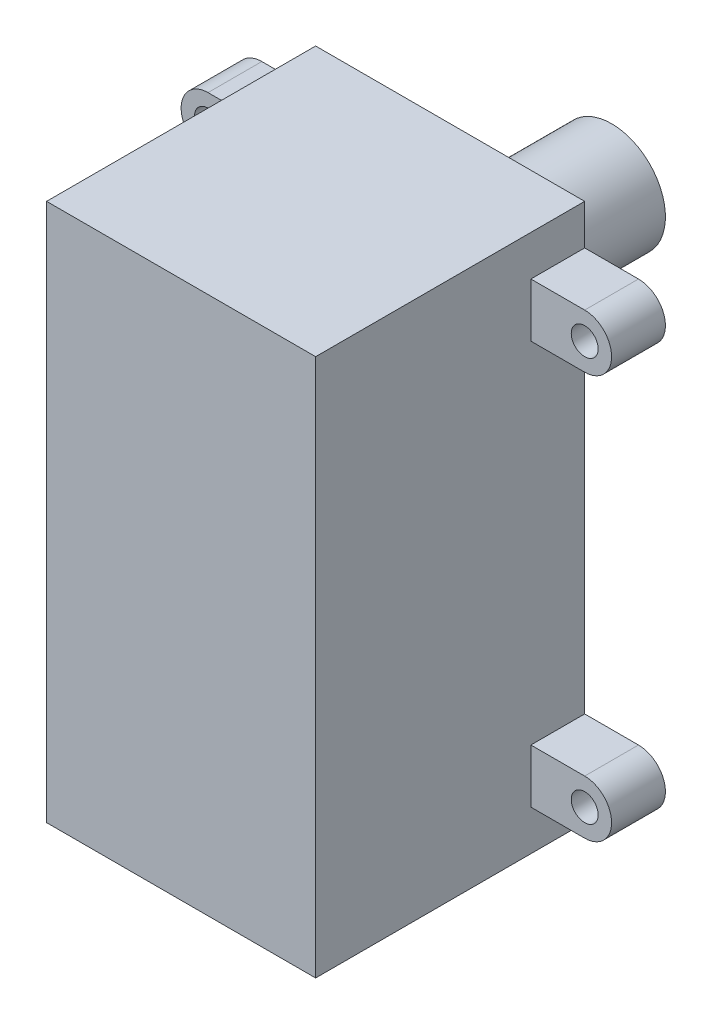
from build123d import *

# Parameters (mm, degrees)
SKETCH1_W           = 100
SKETCH1_H           = 50
BOSS_EXTRUDE1_DEPTH = 50
SKETCH2_R           = 2.5
BOSS_EXTRUDE2_DEPTH = 10
SKETCH3_R           = 10
BOSS_EXTRUDE3_DEPTH = 30


with BuildPart() as part:
    # Sketch1 → Boss-Extrude1 (new body)
    with BuildSketch(Plane(origin=(0, 0, 0), x_dir=(0, 1, 0), z_dir=(0, 0, 1))):
        with Locations((45, -21.706161137)):
            Rectangle(SKETCH1_W, SKETCH1_H)
    extrude(amount=BOSS_EXTRUDE1_DEPTH)

    # Sketch2 → Boss-Extrude2 (add)
    # profile 1 of 4: a face of its own
    with BuildSketch(Plane(origin=(0, 0, 0), x_dir=(1, 0, 0), z_dir=(0, 0, -1))):
        with BuildLine():
            Line((-3.293838863, -2.5), (-13.293838863, -2.5))
            ThreePointArc((-13.293838863, -2.5), (-18.293838863, -7.5), (-13.293838863, -12.5))
            Line((-13.293838863, -12.5), (-3.293838863, -12.5))
            Line((-3.293838863, -12.5), (-3.293838863, -2.5))
        make_face()
        with Locations(Location((-13.293838863, -7.5, 0), (0, 0, 180))):
            Circle(SKETCH2_R, mode=Mode.SUBTRACT)
    # profile 2 of 4: a face of its own
    with BuildSketch(Plane(origin=(0, 0, 0), x_dir=(1, 0, 0), z_dir=(0, 0, -1))):
        with BuildLine():
            Line((-3.293838863, -77.5), (-3.293838863, -87.5))
            Line((-3.293838863, -87.5), (-13.293838863, -87.5))
            ThreePointArc((-13.293838863, -87.5), (-18.293838863, -82.5), (-13.293838863, -77.5))
            Line((-13.293838863, -77.5), (-3.293838863, -77.5))
        make_face()
        with Locations((-13.293838863, -82.5)):
            Circle(SKETCH2_R, mode=Mode.SUBTRACT)
    # profile 3 of 4: a face of its own
    with BuildSketch(Plane(origin=(0, 0, 0), x_dir=(1, 0, 0), z_dir=(0, 0, -1))):
        with BuildLine():
            Line((46.706161137, -87.5), (56.706161137, -87.5))
            ThreePointArc((56.706161137, -87.5), (61.706161137, -82.5), (56.706161137, -77.5))
            Line((56.706161137, -77.5), (46.706161137, -77.5))
            Line((46.706161137, -77.5), (46.706161137, -87.5))
        make_face()
        with Locations(Location((56.706161137, -82.5, 0), (0, 0, 180))):
            Circle(SKETCH2_R, mode=Mode.SUBTRACT)
    # profile 4 of 4: a face of its own
    with BuildSketch(Plane(origin=(0, 0, 0), x_dir=(1, 0, 0), z_dir=(0, 0, -1))):
        with BuildLine():
            Line((46.706161137, -12.5), (46.706161137, -2.5))
            Line((46.706161137, -2.5), (56.706161137, -2.5))
            ThreePointArc((56.706161137, -2.5), (61.706161137, -7.5), (56.706161137, -12.5))
            Line((56.706161137, -12.5), (46.706161137, -12.5))
        make_face()
        with Locations((56.706161137, -7.5)):
            Circle(SKETCH2_R, mode=Mode.SUBTRACT)
    extrude(amount=-BOSS_EXTRUDE2_DEPTH)

    # Sketch3 → Boss-Extrude3 (add)
    with BuildSketch(Plane(origin=(0, 0, 0), x_dir=(1, 0, 0), z_dir=(0, 0, -1))):
        with Locations(Location((21.706161137, -70, 0), (0, 0, 180))):
            Circle(SKETCH3_R)
    extrude(amount=BOSS_EXTRUDE3_DEPTH)


solid = part.part
